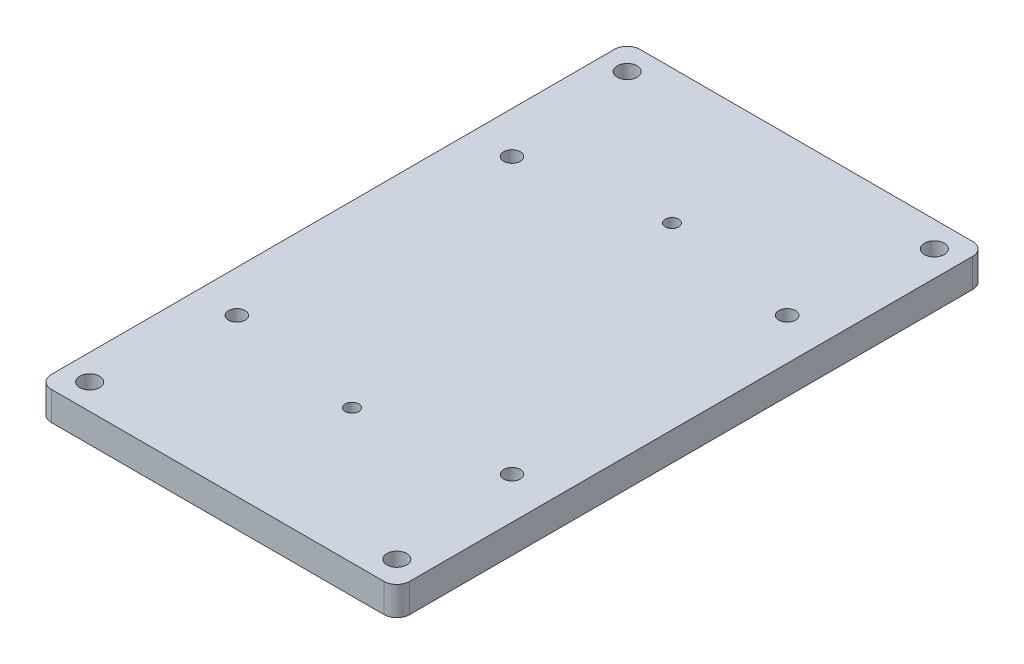
from build123d import *

# Parameters (mm, degrees)
SKETCH1_R           = 1.55
SKETCH1_R_2         = 1.3
SKETCH1_R_3         = 1.05
BOSS_EXTRUDE1_DEPTH = 4.5


with BuildPart() as part:
    # Sketch1 → Boss-Extrude1 (new body)
    with BuildSketch(Plane(origin=(0, 0, 0), x_dir=(1, 0, 0), z_dir=(0, 1, 0))):
        with BuildLine():
            Line((-26, -46), (26, -46))
            ThreePointArc((26, -46), (27.414213562, -45.414213562), (28, -44))
            Line((28, -44), (28, 44))
            ThreePointArc((28, 44), (27.414213562, 45.414213562), (26, 46))
            Line((26, 46), (-26, 46))
            ThreePointArc((-26, 46), (-27.414213562, 45.414213562), (-28, 44))
            Line((-28, 44), (-28, -44))
            ThreePointArc((-28, -44), (-27.414213562, -45.414213562), (-26, -46))
        make_face()
        with Locations(Location((24, 42, 0), (0, 0, 270))):
            Circle(SKETCH1_R, mode=Mode.SUBTRACT)
        with Locations(Location((24, -42, 0), (0, 0, 90))):
            Circle(SKETCH1_R, mode=Mode.SUBTRACT)
        with Locations(Location((-24, 42, 0), (0, 0, 90))):
            Circle(SKETCH1_R, mode=Mode.SUBTRACT)
        with Locations(Location((-24, -42, 0), (0, 0, 270))):
            Circle(SKETCH1_R, mode=Mode.SUBTRACT)
        with Locations(Location((-21.5, 21.5, 0), (0, 0, 270))):
            Circle(SKETCH1_R_2, mode=Mode.SUBTRACT)
        with Locations(Location((21.5, 21.5, 0), (0, 0, 90))):
            Circle(SKETCH1_R_2, mode=Mode.SUBTRACT)
        with Locations(Location((21.5, -21.5, 0), (0, 0, 270))):
            Circle(SKETCH1_R_2, mode=Mode.SUBTRACT)
        with Locations(Location((-21.5, -21.5, 0), (0, 0, 90))):
            Circle(SKETCH1_R_2, mode=Mode.SUBTRACT)
        with Locations(Location((0, 25, 0), (0, 0, 270))):
            Circle(SKETCH1_R_3, mode=Mode.SUBTRACT)
        with Locations(Location((0, -25, 0), (0, 0, 90))):
            Circle(SKETCH1_R_3, mode=Mode.SUBTRACT)
    extrude(amount=BOSS_EXTRUDE1_DEPTH)


solid = part.part
